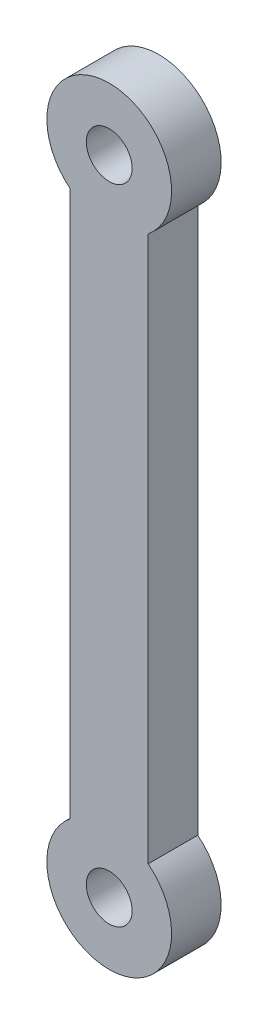
from build123d import *

# Parameters (mm, degrees)
SKETCH1_R           = 1.47
BOSS_EXTRUDE1_DEPTH = 3.18


with BuildPart() as part:
    # Sketch1 → Boss-Extrude1 (new body)
    with BuildSketch(Plane.XY):
        with BuildLine():
            Line((-2.5, 3.122498999), (-2.5, 38.122498999))
            ThreePointArc((-2.5, 38.122498999), (0, 45.244997998), (2.5, 38.122498999))
            Line((2.5, 38.122498999), (2.5, 3.122498999))
            ThreePointArc((2.5, 3.122498999), (3.097295968, 2.53115738), (3.557837147, 1.828057667))
            ThreePointArc((3.557837147, 1.828057667), (3.919871775, -0.796621158), (2.562060699, -3.071782052))
            ThreePointArc((2.562060699, -3.071782052), (-3.097295968, -2.53115738), (-2.5, 3.122498999))
        make_face()
        with Locations(Location((0, 41.244997998, 0), (0, 0, 180))):
            Circle(SKETCH1_R, mode=Mode.SUBTRACT)
        with Locations(Location((0, 0, 0), (0, 0, 180))):
            Circle(SKETCH1_R, mode=Mode.SUBTRACT)
    extrude(amount=BOSS_EXTRUDE1_DEPTH)


solid = part.part
